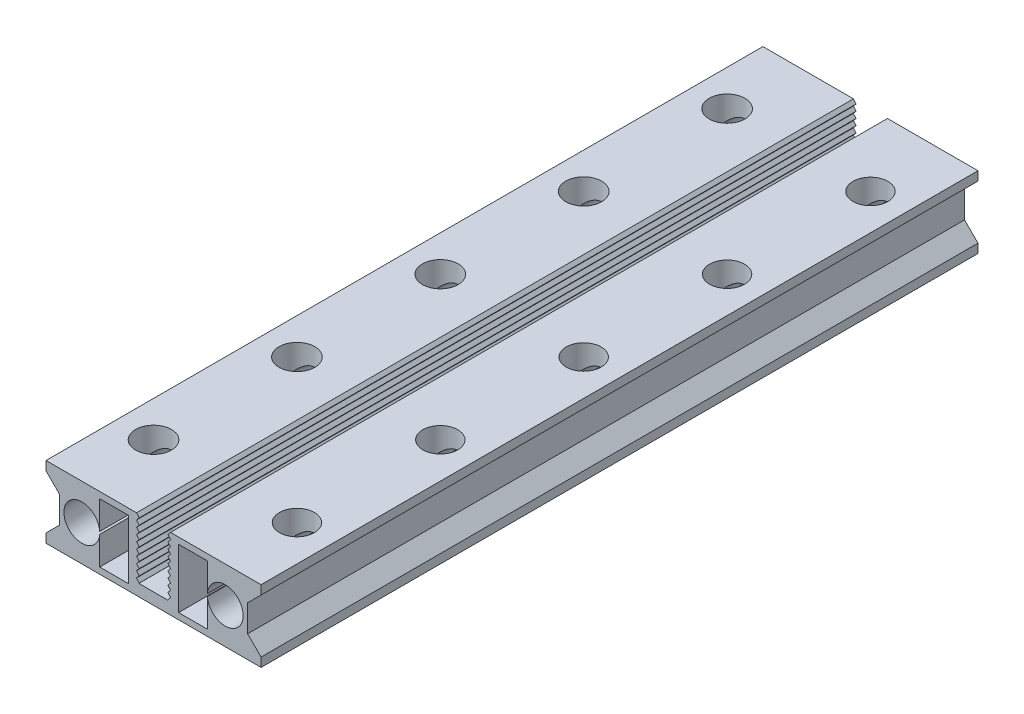
from build123d import *

# Parameters (mm, degrees)
EXTRUDE_2_DEPTH        = 80
EXTRUDE_3_DEPTH        = 80
PATTERN_LINEAR_1_COUNT = 10
PATTERN_LINEAR_1_PITCH = 0.7
MIRROR_1_COPY_1_DEPTH  = 80
MIRROR_1_COPY_2_DEPTH  = 80
MIRROR_1_COPY_3_DEPTH  = 80
MIRROR_1_COPY_4_DEPTH  = 80
MIRROR_1_COPY_5_DEPTH  = 80
MIRROR_1_COPY_6_DEPTH  = 80
MIRROR_1_COPY_7_DEPTH  = 80
MIRROR_1_COPY_8_DEPTH  = 80
MIRROR_1_COPY_9_DEPTH  = 80
SKETCH_4_R             = 2
SKETCH_4_R_2           = 1.95
CUT_EXTRUDE_1_DEPTH    = 82.289605732
PATTERN_LINEAR_2_COUNT = 5
PATTERN_LINEAR_2_PITCH = 16


with BuildPart() as part:
    # 草图1 → 凸台-拉伸2 (new body)
    with BuildSketch(Plane.XY):
        Polygon((-1.9, 8), (-12, 8), (-12, 7), (-10.5, 5.5), (-10.5, 2.5), (-12, 1), (-12, 0), (12, 0), (12, 1), (10.5, 2.5), (10.5, 5.5), (12, 7), (12, 8), (1.9, 8), (1.9, 1.3), (-1.9, 1.3), align=None)
        with BuildLine():
            Line((-6.005, 4.14133294), (-6.005, 7.3))
            Line((-6.005, 7.3), (-2.8, 7.3))
            Line((-2.8, 7.3), (-2.8, 0.7))
            Line((-2.8, 0.7), (-6.005, 0.7))
            Line((-6.005, 0.7), (-6.005, 3.85866706))
            ThreePointArc((-6.005, 3.85866706), (-10, 4), (-6.005, 4.14133294))
        make_face(mode=Mode.SUBTRACT)
        with BuildLine():
            Line((2.8, 0.7), (2.8, 7.3))
            Line((2.8, 7.3), (6.005, 7.3))
            Line((6.005, 7.3), (6.005, 4.14133294))
            ThreePointArc((6.005, 4.14133294), (10, 4), (6.005, 3.85866706))
            Line((6.005, 3.85866706), (6.005, 0.7))
            Line((6.005, 0.7), (2.8, 0.7))
        make_face(mode=Mode.SUBTRACT)
    extrude(amount=EXTRUDE_2_DEPTH)

    # 草图3 → 凸台-拉伸3 (add)
    with BuildSketch(Plane.XY.offset(80)):
        Polygon((-1.9, 8), (-1.6, 7.65), (-1.9, 7.3), align=None)
    extrude_3 = extrude(amount=-EXTRUDE_3_DEPTH)

    # 阵列(线性)1: 凸台-拉伸3 ×10
    with Locations(*[(0, -i * PATTERN_LINEAR_1_PITCH, 0) for i in range(1, PATTERN_LINEAR_1_COUNT)]):
        add(extrude_3)

    # 镜向1: 凸台-拉伸3 across plane
    add(extrude_3.mirror(Plane(origin=(0, 0, 0), x_dir=(0, 0, 1), z_dir=(1, 0, 0))))

    # 镜向1 copy 1 sketch → 镜向1 copy 1 (add)
    with BuildSketch(Plane(origin=(0, -0.7, 80), x_dir=(-1, 0, 0), z_dir=(0, 0, 1))):
        Polygon((-1.9, -8), (-1.6, -7.65), (-1.9, -7.3), align=None)
    extrude(amount=-MIRROR_1_COPY_1_DEPTH)

    # 镜向1 copy 2 sketch → 镜向1 copy 2 (add)
    with BuildSketch(Plane(origin=(0, -1.4, 80), x_dir=(-1, 0, 0), z_dir=(0, 0, 1))):
        Polygon((-1.9, -8), (-1.6, -7.65), (-1.9, -7.3), align=None)
    extrude(amount=-MIRROR_1_COPY_2_DEPTH)

    # 镜向1 copy 3 sketch → 镜向1 copy 3 (add)
    with BuildSketch(Plane(origin=(0, -2.1, 80), x_dir=(-1, 0, 0), z_dir=(0, 0, 1))):
        Polygon((-1.9, -8), (-1.6, -7.65), (-1.9, -7.3), align=None)
    extrude(amount=-MIRROR_1_COPY_3_DEPTH)

    # 镜向1 copy 4 sketch → 镜向1 copy 4 (add)
    with BuildSketch(Plane(origin=(0, -2.8, 80), x_dir=(-1, 0, 0), z_dir=(0, 0, 1))):
        Polygon((-1.9, -8), (-1.6, -7.65), (-1.9, -7.3), align=None)
    extrude(amount=-MIRROR_1_COPY_4_DEPTH)

    # 镜向1 copy 5 sketch → 镜向1 copy 5 (add)
    with BuildSketch(Plane(origin=(0, -3.5, 80), x_dir=(-1, 0, 0), z_dir=(0, 0, 1))):
        Polygon((-1.9, -8), (-1.6, -7.65), (-1.9, -7.3), align=None)
    extrude(amount=-MIRROR_1_COPY_5_DEPTH)

    # 镜向1 copy 6 sketch → 镜向1 copy 6 (add)
    with BuildSketch(Plane(origin=(0, -4.2, 80), x_dir=(-1, 0, 0), z_dir=(0, 0, 1))):
        Polygon((-1.9, -8), (-1.6, -7.65), (-1.9, -7.3), align=None)
    extrude(amount=-MIRROR_1_COPY_6_DEPTH)

    # 镜向1 copy 7 sketch → 镜向1 copy 7 (add)
    with BuildSketch(Plane(origin=(0, -4.9, 80), x_dir=(-1, 0, 0), z_dir=(0, 0, 1))):
        Polygon((-1.9, -8), (-1.6, -7.65), (-1.9, -7.3), align=None)
    extrude(amount=-MIRROR_1_COPY_7_DEPTH)

    # 镜向1 copy 8 sketch → 镜向1 copy 8 (add)
    with BuildSketch(Plane(origin=(0, -5.6, 80), x_dir=(-1, 0, 0), z_dir=(0, 0, 1))):
        Polygon((-1.9, -8), (-1.6, -7.65), (-1.9, -7.3), align=None)
    extrude(amount=-MIRROR_1_COPY_8_DEPTH)

    # 镜向1 copy 9 sketch → 镜向1 copy 9 (add)
    with BuildSketch(Plane(origin=(0, -6.3, 80), x_dir=(-1, 0, 0), z_dir=(0, 0, 1))):
        Polygon((-1.9, -8), (-1.6, -7.65), (-1.9, -7.3), align=None)
    extrude(amount=-MIRROR_1_COPY_9_DEPTH)

    # 草图4 → 切除-拉伸1 (cut, through all)
    with BuildSketch(Plane(origin=(0, 8, 0), x_dir=(1, 0, 0), z_dir=(0, 1, 0))):
        with Locations(Location((-8, -8, 0), (0, 0, 180))):
            Circle(SKETCH_4_R)
        with Locations(Location((8, -8, 0), (0, 0, 180))):
            Circle(SKETCH_4_R_2)
    cut_extrude_1 = extrude(amount=-CUT_EXTRUDE_1_DEPTH, mode=Mode.SUBTRACT)

    # 阵列(线性)2: 切除-拉伸1 ×5
    with Locations(*[(0, 0, i * PATTERN_LINEAR_2_PITCH) for i in range(1, PATTERN_LINEAR_2_COUNT)]):
        add(cut_extrude_1, mode=Mode.SUBTRACT)


solid = part.part
